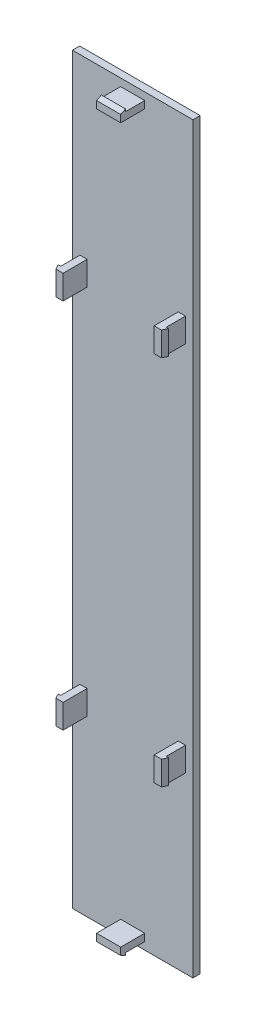
from build123d import *

# Parameters (mm, degrees)
SKETCH2_W            = 154.25
SKETCH2_H            = 25
BOSS_EXTRUDE1_DEPTH  = 1.5
SKETCH3_W            = 5
SKETCH3_H            = 1.5
BOSS_EXTRUDE2_DEPTH  = 5
BOSS_EXTRUDE3_DEPTH  = 5
SKETCH5_W            = 1.5
SKETCH5_H            = 5
BOSS_EXTRUDE4_DEPTH  = 5
BOSS_EXTRUDE5_DEPTH  = 5
MIRROR5_COPY_1_DEPTH = 5


with BuildPart() as part:
    # Sketch2 → Boss-Extrude1 (new body)
    with BuildSketch(Plane(origin=(0, 0, 0), x_dir=(0, 1, 0), z_dir=(0, 0, 1))):
        with Locations((77.125, 12.5)):
            Rectangle(SKETCH2_W, SKETCH2_H)
    extrude(amount=BOSS_EXTRUDE1_DEPTH)

    # Sketch3 → Boss-Extrude2 (add)
    with BuildSketch(Plane.XY.offset(1.5)):
        with Locations((-12.5, 2.3)):
            Rectangle(SKETCH3_W, SKETCH3_H)
    boss_extrude2 = extrude(amount=BOSS_EXTRUDE2_DEPTH)

    # Sketch4 → Boss-Extrude3 (add)
    with BuildSketch(Plane.YZ.offset(-10)):
        Polygon((1.55, 6.5), (1.05, 5.5), (1.55, 5.5), align=None)
    boss_extrude3 = extrude(amount=-BOSS_EXTRUDE3_DEPTH)

    # Sketch5 → Boss-Extrude4 (add)
    with BuildSketch(Plane.XY.offset(1.5)):
        with Locations((-2.3, 38.5625)):
            Rectangle(SKETCH5_W, SKETCH5_H)
        with Locations((-2.3, 115.6875)):
            Rectangle(SKETCH5_W, SKETCH5_H)
    boss_extrude4 = extrude(amount=BOSS_EXTRUDE4_DEPTH)

    # Sketch6 → Boss-Extrude5 (add)
    with BuildSketch(Plane.XZ.offset(-36.0625)):
        Polygon((-1.55, 6.5), (-1.05, 5.5), (-1.55, 5.5), align=None)
    boss_extrude5 = extrude(amount=-BOSS_EXTRUDE5_DEPTH)

    # Mirror2: Boss-Extrude5 across plane
    add(boss_extrude5.mirror(Plane(origin=(0, 77.125, 0), x_dir=(0, 0, 1), z_dir=(0, -1, 0))))

    # Mirror3: Boss-Extrude2 across plane
    add(boss_extrude2.mirror(Plane(origin=(0, 77.125, 0), x_dir=(0, 0, 1), z_dir=(0, -1, 0))))

    # Mirror4: Boss-Extrude3 across plane
    add(boss_extrude3.mirror(Plane(origin=(0, 77.125, 0), x_dir=(0, 0, 1), z_dir=(0, -1, 0))))

    # Mirror5: Boss-Extrude4, Boss-Extrude5 across plane
    add(boss_extrude4.mirror(Plane(origin=(-12.5, 0, 0), x_dir=(0, 0, 1), z_dir=(1, 0, 0))))
    add(boss_extrude5.mirror(Plane(origin=(-12.5, 0, 0), x_dir=(0, 0, 1), z_dir=(1, 0, 0))))

    # Mirror5 copy 1 sketch → Mirror5 copy 1 (add)
    with BuildSketch(Plane(origin=(-25, 118.1875, 0), x_dir=(-1, 0, 0), z_dir=(0, 1, 0))):
        Polygon((-1.55, 6.5), (-1.05, 5.5), (-1.55, 5.5), align=None)
    extrude(amount=-MIRROR5_COPY_1_DEPTH)


solid = part.part
